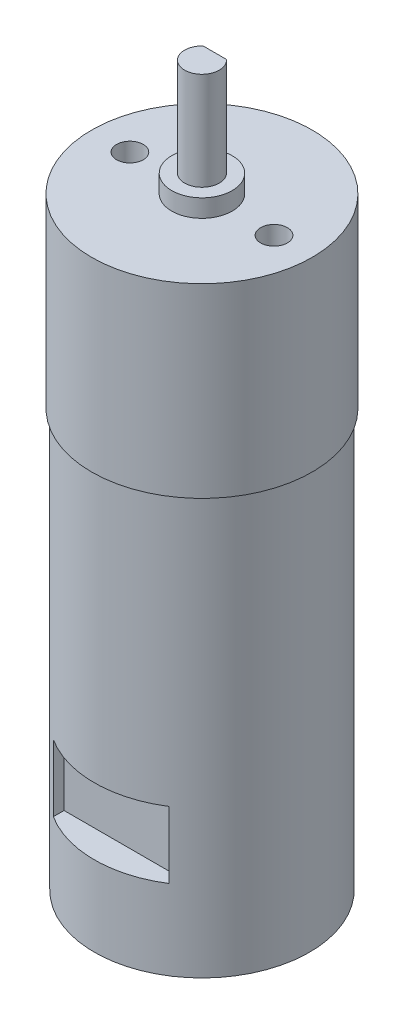
from build123d import *

# Parameters (mm, degrees)
SKETCH1_R           = 12.4
BOSS_EXTRUDE1_DEPTH = 20.9
SKETCH4_R           = 3.4
BOSS_EXTRUDE3_DEPTH = 2
SKETCH6_R           = 1.95
BOSS_EXTRUDE4_DEPTH = 11
CUT_EXTRUDE1_DEPTH  = 10
SKETCH8_R           = 12.1
BOSS_EXTRUDE5_DEPTH = 46.9
SKETCH9_R           = 1.5
CUT_EXTRUDE2_DEPTH  = 5
SKETCH10_W          = 13
SKETCH10_H          = 7.5
CUT_EXTRUDE3_DEPTH  = 4


with BuildPart() as part:
    # Sketch1 → Boss-Extrude1 (new body)
    with BuildSketch(Plane(origin=(0, 0, 0), x_dir=(1, 0, 0), z_dir=(0, 1, 0))):
        with Locations(Location((0, 0, 0), (0, 0, 270))):
            Circle(SKETCH1_R)
    extrude(amount=BOSS_EXTRUDE1_DEPTH)

    # Sketch4 → Boss-Extrude3 (add)
    with BuildSketch(Plane(origin=(0, 20.9, 0), x_dir=(1, 0, 0), z_dir=(0, 1, 0))):
        with Locations(Location((0, 0, 0), (0, 0, 270))):
            Circle(SKETCH4_R)
    extrude(amount=BOSS_EXTRUDE3_DEPTH)

    # Sketch6 → Boss-Extrude4 (add)
    with BuildSketch(Plane(origin=(0, 22.9, 0), x_dir=(1, 0, 0), z_dir=(0, 1, 0))):
        with Locations(Location((0, 0, 0), (0, 0, 270))):
            Circle(SKETCH6_R)
    extrude(amount=BOSS_EXTRUDE4_DEPTH)

    # Sketch7 → Cut-Extrude1 (cut)
    with BuildSketch(Plane(origin=(0, 33.9, 0), x_dir=(1, 0, 0), z_dir=(0, 1, 0))):
        Polygon((0, 1.45), (-1.840503263, 1.45), (-1.840503263, 3.329277937), (1.844863843, 3.329277937), (1.844863843, 1.45), align=None)
    extrude(amount=-CUT_EXTRUDE1_DEPTH, mode=Mode.SUBTRACT)

    # Sketch8 → Boss-Extrude5 (add)
    with BuildSketch(Plane.XZ):
        with Locations(Location((0, 0, 0), (0, 0, 270))):
            Circle(SKETCH8_R)
    extrude(amount=BOSS_EXTRUDE5_DEPTH)

    # Sketch9 → Cut-Extrude2 (cut)
    with BuildSketch(Plane(origin=(0, 20.9, 0), x_dir=(1, 0, 0), z_dir=(0, 1, 0))):
        with Locations(Location((-8.1, 0, 0), (0, 0, 270))):
            Circle(SKETCH9_R)
        with Locations(Location((8.1, 0, 0), (0, 0, 90))):
            Circle(SKETCH9_R)
    extrude(amount=-CUT_EXTRUDE2_DEPTH, mode=Mode.SUBTRACT)

    # Sketch10 → Cut-Extrude3 (cut)
    with BuildSketch(Plane.XY.offset(13)):
        with Locations((0, -34.15)):
            Rectangle(SKETCH10_W, SKETCH10_H)
    extrude(amount=-CUT_EXTRUDE3_DEPTH, mode=Mode.SUBTRACT)


solid = part.part
